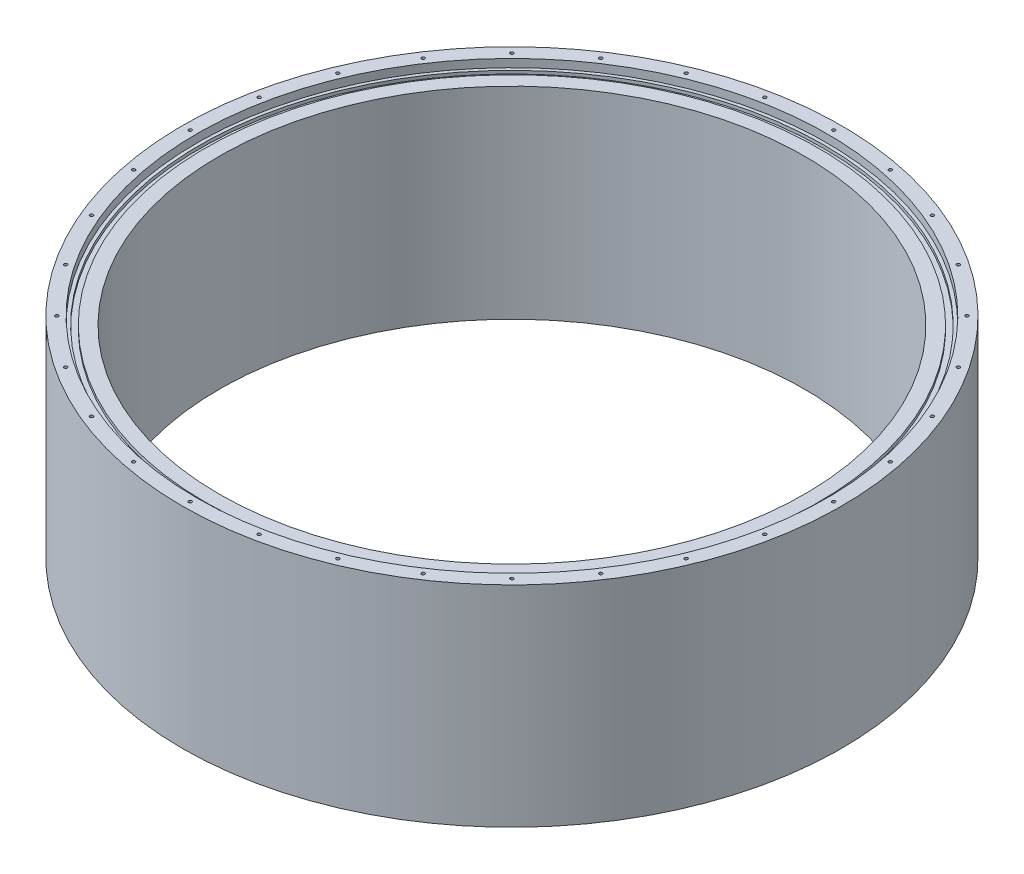
from build123d import *

# Parameters (mm, degrees)
SKETCH2_W                 = 4.1656
SKETCH2_H                 = 2.413
CIRPATTERN1_COUNT         = 32
F_5_0MM_DOWEL_HOLE1_D     = 5.05
F_5_0MM_DOWEL_HOLE1_DEPTH = 6
F_5_0MM_DOWEL_HOLE1_TIP   = 1.517173063


with BuildPart() as part:
    # Sketch1 → Revolve1 (revolve)
    with BuildSketch(Plane.XY, mode=Mode.PRIVATE) as revolve1_sk:
        Polygon((225.6, 74.685), (243, 74.685), (243, 80.885), (254, 80.885), (254, -80.885), (225.6, -80.885), align=None)
    revolve(revolve1_sk.sketch.rotate(Axis((0, 80.885, 0), (0, -1, 0)), 90), axis=Axis((0, 80.885, 0), (0, -1, 0)))

    # Sketch2 → Cut-Revolve1 (revolve, cut)
    with BuildSketch(Plane.XY, mode=Mode.PRIVATE) as cut_revolve1_sk:
        with Locations((238.4172, 73.4785)):
            Rectangle(SKETCH2_W, SKETCH2_H)
    revolve(cut_revolve1_sk.sketch.rotate(Axis((0, 80.885, 0), (0, -1, 0)), 90), axis=Axis((0, 80.885, 0), (0, -1, 0)), mode=Mode.SUBTRACT)

    # Sketch4 → M3x0.5 Tapped Hole1 (revolve, cut)
    with BuildSketch(Plane(origin=(248, 80.885, 0), x_dir=(0, 0, 1), z_dir=(1, 0, 0))):
        Polygon((0, 0), (0, 10.251075774), (1.25, 9.5), (1.25, 0), align=None)
    m3x0_5_tapped_hole1 = revolve(axis=Axis((248, 87.235, 0), (0, -1, 0)), mode=Mode.SUBTRACT)

    # CirPattern1: M3x0.5 Tapped Hole1 ×32 about axis
    cirpattern1_axis = Axis((0, 0, 0), (0, 1, 0))
    for i in range(1, CIRPATTERN1_COUNT):
        add(m3x0_5_tapped_hole1.rotate(cirpattern1_axis, i * 360 / CIRPATTERN1_COUNT), mode=Mode.SUBTRACT)

    # Mirror1: M3x0.5 Tapped Hole1 across plane
    add(m3x0_5_tapped_hole1.mirror(Plane.ZX), mode=Mode.SUBTRACT)

    # Mirror1 copy 1 sketch → Mirror1 copy 1 (revolve, cut)
    with BuildSketch(Plane(origin=(243.23474954, -80.885, -48.38239986), x_dir=(0.19509032201612825, 0, 0.9807852804032304), z_dir=(0.9807852804032304, 0, -0.19509032201612825))):
        Polygon((0, 0), (0, -10.251075774), (1.25, -9.5), (1.25, 0), align=None)
    revolve(axis=Axis((243.23474954, -87.235, -48.38239986), (0, -1, 0)), mode=Mode.SUBTRACT)

    # Mirror1 copy 2 sketch → Mirror1 copy 2 (revolve, cut)
    with BuildSketch(Plane(origin=(229.122124063, -80.885, -94.905491227), x_dir=(0.3826834323650898, 0, 0.9238795325112867), z_dir=(0.9238795325112867, 0, -0.3826834323650898))):
        Polygon((0, 0), (0, -10.251075774), (1.25, -9.5), (1.25, 0), align=None)
    revolve(axis=Axis((229.122124063, -87.235, -94.905491227), (0, -1, 0)), mode=Mode.SUBTRACT)

    # Mirror1 copy 3 sketch → Mirror1 copy 3 (revolve, cut)
    with BuildSketch(Plane(origin=(206.204463851, -80.885, -137.781417789), x_dir=(0.5555702330196022, 0, 0.8314696123025452), z_dir=(0.8314696123025452, 0, -0.5555702330196022))):
        Polygon((0, 0), (0, -10.251075774), (1.25, -9.5), (1.25, 0), align=None)
    revolve(axis=Axis((206.204463851, -87.235, -137.781417789), (0, -1, 0)), mode=Mode.SUBTRACT)

    # Mirror1 copy 4 sketch → Mirror1 copy 4 (revolve, cut)
    with BuildSketch(Plane(origin=(175.362481734, -80.885, -175.362481734), x_dir=(0.7071067811865475, 0, 0.7071067811865476), z_dir=(0.7071067811865476, 0, -0.7071067811865475))):
        Polygon((0, 0), (0, -10.251075774), (1.25, -9.5), (1.25, 0), align=None)
    revolve(axis=Axis((175.362481734, -87.235, -175.362481734), (0, -1, 0)), mode=Mode.SUBTRACT)

    # Mirror1 copy 5 sketch → Mirror1 copy 5 (revolve, cut)
    with BuildSketch(Plane(origin=(137.781417789, -80.885, -206.204463851), x_dir=(0.8314696123025452, 0, 0.5555702330196023), z_dir=(0.5555702330196023, 0, -0.8314696123025452))):
        Polygon((0, 0), (0, -10.251075774), (1.25, -9.5), (1.25, 0), align=None)
    revolve(axis=Axis((137.781417789, -87.235, -206.204463851), (0, -1, 0)), mode=Mode.SUBTRACT)

    # Mirror1 copy 6 sketch → Mirror1 copy 6 (revolve, cut)
    with BuildSketch(Plane(origin=(94.905491227, -80.885, -229.122124063), x_dir=(0.9238795325112867, 0, 0.38268343236508984), z_dir=(0.38268343236508984, 0, -0.9238795325112867))):
        Polygon((0, 0), (0, -10.251075774), (1.25, -9.5), (1.25, 0), align=None)
    revolve(axis=Axis((94.905491227, -87.235, -229.122124063), (0, -1, 0)), mode=Mode.SUBTRACT)

    # Mirror1 copy 7 sketch → Mirror1 copy 7 (revolve, cut)
    with BuildSketch(Plane(origin=(48.38239986, -80.885, -243.23474954), x_dir=(0.9807852804032304, 0, 0.19509032201612833), z_dir=(0.19509032201612833, 0, -0.9807852804032304))):
        Polygon((0, 0), (0, -10.251075774), (1.25, -9.5), (1.25, 0), align=None)
    revolve(axis=Axis((48.38239986, -87.235, -243.23474954), (0, -1, 0)), mode=Mode.SUBTRACT)

    # Mirror1 copy 8 sketch → Mirror1 copy 8 (revolve, cut)
    with BuildSketch(Plane(origin=(0, -80.885, -248), x_dir=(1, 0, 0), z_dir=(0, 0, -1))):
        Polygon((0, 0), (0, -10.251075774), (1.25, -9.5), (1.25, 0), align=None)
    revolve(axis=Axis((0, -87.235, -248), (0, -1, 0)), mode=Mode.SUBTRACT)

    # Mirror1 copy 9 sketch → Mirror1 copy 9 (revolve, cut)
    with BuildSketch(Plane(origin=(-48.38239986, -80.885, -243.23474954), x_dir=(0.9807852804032304, 0, -0.1950903220161282), z_dir=(-0.1950903220161282, 0, -0.9807852804032304))):
        Polygon((0, 0), (0, -10.251075774), (1.25, -9.5), (1.25, 0), align=None)
    revolve(axis=Axis((-48.38239986, -87.235, -243.23474954), (0, -1, 0)), mode=Mode.SUBTRACT)

    # Mirror1 copy 10 sketch → Mirror1 copy 10 (revolve, cut)
    with BuildSketch(Plane(origin=(-94.905491227, -80.885, -229.122124063), x_dir=(0.9238795325112867, 0, -0.3826834323650897), z_dir=(-0.3826834323650897, 0, -0.9238795325112867))):
        Polygon((0, 0), (0, -10.251075774), (1.25, -9.5), (1.25, 0), align=None)
    revolve(axis=Axis((-94.905491227, -87.235, -229.122124063), (0, -1, 0)), mode=Mode.SUBTRACT)

    # Mirror1 copy 11 sketch → Mirror1 copy 11 (revolve, cut)
    with BuildSketch(Plane(origin=(-137.781417789, -80.885, -206.204463851), x_dir=(0.8314696123025451, 0, -0.5555702330196023), z_dir=(-0.5555702330196023, 0, -0.8314696123025451))):
        Polygon((0, 0), (0, -10.251075774), (1.25, -9.5), (1.25, 0), align=None)
    revolve(axis=Axis((-137.781417789, -87.235, -206.204463851), (0, -1, 0)), mode=Mode.SUBTRACT)

    # Mirror1 copy 12 sketch → Mirror1 copy 12 (revolve, cut)
    with BuildSketch(Plane(origin=(-175.362481734, -80.885, -175.362481734), x_dir=(0.7071067811865476, 0, -0.7071067811865475), z_dir=(-0.7071067811865475, 0, -0.7071067811865476))):
        Polygon((0, 0), (0, -10.251075774), (1.25, -9.5), (1.25, 0), align=None)
    revolve(axis=Axis((-175.362481734, -87.235, -175.362481734), (0, -1, 0)), mode=Mode.SUBTRACT)

    # Mirror1 copy 13 sketch → Mirror1 copy 13 (revolve, cut)
    with BuildSketch(Plane(origin=(-206.204463851, -80.885, -137.781417789), x_dir=(0.5555702330196022, 0, -0.8314696123025453), z_dir=(-0.8314696123025453, 0, -0.5555702330196022))):
        Polygon((0, 0), (0, -10.251075774), (1.25, -9.5), (1.25, 0), align=None)
    revolve(axis=Axis((-206.204463851, -87.235, -137.781417789), (0, -1, 0)), mode=Mode.SUBTRACT)

    # Mirror1 copy 14 sketch → Mirror1 copy 14 (revolve, cut)
    with BuildSketch(Plane(origin=(-229.122124063, -80.885, -94.905491227), x_dir=(0.3826834323650899, 0, -0.9238795325112867), z_dir=(-0.9238795325112867, 0, -0.3826834323650899))):
        Polygon((0, 0), (0, -10.251075774), (1.25, -9.5), (1.25, 0), align=None)
    revolve(axis=Axis((-229.122124063, -87.235, -94.905491227), (0, -1, 0)), mode=Mode.SUBTRACT)

    # Mirror1 copy 15 sketch → Mirror1 copy 15 (revolve, cut)
    with BuildSketch(Plane(origin=(-243.23474954, -80.885, -48.38239986), x_dir=(0.19509032201612816, 0, -0.9807852804032304), z_dir=(-0.9807852804032304, 0, -0.19509032201612816))):
        Polygon((0, 0), (0, -10.251075774), (1.25, -9.5), (1.25, 0), align=None)
    revolve(axis=Axis((-243.23474954, -87.235, -48.38239986), (0, -1, 0)), mode=Mode.SUBTRACT)

    # Mirror1 copy 16 sketch → Mirror1 copy 16 (revolve, cut)
    with BuildSketch(Plane(origin=(-248, -80.885, 0), x_dir=(0, 0, -1), z_dir=(-1, 0, 0))):
        Polygon((0, 0), (0, -10.251075774), (1.25, -9.5), (1.25, 0), align=None)
    revolve(axis=Axis((-248, -87.235, 0), (0, -1, 0)), mode=Mode.SUBTRACT)

    # Mirror1 copy 17 sketch → Mirror1 copy 17 (revolve, cut)
    with BuildSketch(Plane(origin=(-243.23474954, -80.885, 48.38239986), x_dir=(-0.19509032201612836, 0, -0.9807852804032304), z_dir=(-0.9807852804032304, 0, 0.19509032201612836))):
        Polygon((0, 0), (0, -10.251075774), (1.25, -9.5), (1.25, 0), align=None)
    revolve(axis=Axis((-243.23474954, -87.235, 48.38239986), (0, -1, 0)), mode=Mode.SUBTRACT)

    # Mirror1 copy 18 sketch → Mirror1 copy 18 (revolve, cut)
    with BuildSketch(Plane(origin=(-229.122124063, -80.885, 94.905491227), x_dir=(-0.38268343236508967, 0, -0.9238795325112868), z_dir=(-0.9238795325112868, 0, 0.38268343236508967))):
        Polygon((0, 0), (0, -10.251075774), (1.25, -9.5), (1.25, 0), align=None)
    revolve(axis=Axis((-229.122124063, -87.235, 94.905491227), (0, -1, 0)), mode=Mode.SUBTRACT)

    # Mirror1 copy 19 sketch → Mirror1 copy 19 (revolve, cut)
    with BuildSketch(Plane(origin=(-206.204463851, -80.885, 137.781417789), x_dir=(-0.5555702330196023, 0, -0.8314696123025452), z_dir=(-0.8314696123025452, 0, 0.5555702330196023))):
        Polygon((0, 0), (0, -10.251075774), (1.25, -9.5), (1.25, 0), align=None)
    revolve(axis=Axis((-206.204463851, -87.235, 137.781417789), (0, -1, 0)), mode=Mode.SUBTRACT)

    # Mirror1 copy 20 sketch → Mirror1 copy 20 (revolve, cut)
    with BuildSketch(Plane(origin=(-175.362481734, -80.885, 175.362481734), x_dir=(-0.7071067811865475, 0, -0.7071067811865477), z_dir=(-0.7071067811865477, 0, 0.7071067811865475))):
        Polygon((0, 0), (0, -10.251075774), (1.25, -9.5), (1.25, 0), align=None)
    revolve(axis=Axis((-175.362481734, -87.235, 175.362481734), (0, -1, 0)), mode=Mode.SUBTRACT)

    # Mirror1 copy 21 sketch → Mirror1 copy 21 (revolve, cut)
    with BuildSketch(Plane(origin=(-137.781417789, -80.885, 206.204463851), x_dir=(-0.8314696123025452, 0, -0.5555702330196022), z_dir=(-0.5555702330196022, 0, 0.8314696123025452))):
        Polygon((0, 0), (0, -10.251075774), (1.25, -9.5), (1.25, 0), align=None)
    revolve(axis=Axis((-137.781417789, -87.235, 206.204463851), (0, -1, 0)), mode=Mode.SUBTRACT)

    # Mirror1 copy 22 sketch → Mirror1 copy 22 (revolve, cut)
    with BuildSketch(Plane(origin=(-94.905491227, -80.885, 229.122124063), x_dir=(-0.9238795325112868, 0, -0.3826834323650895), z_dir=(-0.3826834323650895, 0, 0.9238795325112868))):
        Polygon((0, 0), (0, -10.251075774), (1.25, -9.5), (1.25, 0), align=None)
    revolve(axis=Axis((-94.905491227, -87.235, 229.122124063), (0, -1, 0)), mode=Mode.SUBTRACT)

    # Mirror1 copy 23 sketch → Mirror1 copy 23 (revolve, cut)
    with BuildSketch(Plane(origin=(-48.38239986, -80.885, 243.23474954), x_dir=(-0.9807852804032303, 0, -0.19509032201612866), z_dir=(-0.19509032201612866, 0, 0.9807852804032303))):
        Polygon((0, 0), (0, -10.251075774), (1.25, -9.5), (1.25, 0), align=None)
    revolve(axis=Axis((-48.38239986, -87.235, 243.23474954), (0, -1, 0)), mode=Mode.SUBTRACT)

    # Mirror1 copy 24 sketch → Mirror1 copy 24 (revolve, cut)
    with BuildSketch(Plane(origin=(0, -80.885, 248), x_dir=(-1, 0, 0), z_dir=(0, 0, 1))):
        Polygon((0, 0), (0, -10.251075774), (1.25, -9.5), (1.25, 0), align=None)
    revolve(axis=Axis((0, -87.235, 248), (0, -1, 0)), mode=Mode.SUBTRACT)

    # Mirror1 copy 25 sketch → Mirror1 copy 25 (revolve, cut)
    with BuildSketch(Plane(origin=(48.38239986, -80.885, 243.23474954), x_dir=(-0.9807852804032304, 0, 0.1950903220161283), z_dir=(0.1950903220161283, 0, 0.9807852804032304))):
        Polygon((0, 0), (0, -10.251075774), (1.25, -9.5), (1.25, 0), align=None)
    revolve(axis=Axis((48.38239986, -87.235, 243.23474954), (0, -1, 0)), mode=Mode.SUBTRACT)

    # Mirror1 copy 26 sketch → Mirror1 copy 26 (revolve, cut)
    with BuildSketch(Plane(origin=(94.905491227, -80.885, 229.122124063), x_dir=(-0.9238795325112866, 0, 0.38268343236509), z_dir=(0.38268343236509, 0, 0.9238795325112866))):
        Polygon((0, 0), (0, -10.251075774), (1.25, -9.5), (1.25, 0), align=None)
    revolve(axis=Axis((94.905491227, -87.235, 229.122124063), (0, -1, 0)), mode=Mode.SUBTRACT)

    # Mirror1 copy 27 sketch → Mirror1 copy 27 (revolve, cut)
    with BuildSketch(Plane(origin=(137.781417789, -80.885, 206.204463851), x_dir=(-0.8314696123025455, 0, 0.5555702330196018), z_dir=(0.5555702330196018, 0, 0.8314696123025455))):
        Polygon((0, 0), (0, -10.251075774), (1.25, -9.5), (1.25, 0), align=None)
    revolve(axis=Axis((137.781417789, -87.235, 206.204463851), (0, -1, 0)), mode=Mode.SUBTRACT)

    # Mirror1 copy 28 sketch → Mirror1 copy 28 (revolve, cut)
    with BuildSketch(Plane(origin=(175.362481734, -80.885, 175.362481734), x_dir=(-0.7071067811865477, 0, 0.7071067811865474), z_dir=(0.7071067811865474, 0, 0.7071067811865477))):
        Polygon((0, 0), (0, -10.251075774), (1.25, -9.5), (1.25, 0), align=None)
    revolve(axis=Axis((175.362481734, -87.235, 175.362481734), (0, -1, 0)), mode=Mode.SUBTRACT)

    # Mirror1 copy 29 sketch → Mirror1 copy 29 (revolve, cut)
    with BuildSketch(Plane(origin=(206.204463851, -80.885, 137.781417789), x_dir=(-0.5555702330196022, 0, 0.8314696123025452), z_dir=(0.8314696123025452, 0, 0.5555702330196022))):
        Polygon((0, 0), (0, -10.251075774), (1.25, -9.5), (1.25, 0), align=None)
    revolve(axis=Axis((206.204463851, -87.235, 137.781417789), (0, -1, 0)), mode=Mode.SUBTRACT)

    # Mirror1 copy 30 sketch → Mirror1 copy 30 (revolve, cut)
    with BuildSketch(Plane(origin=(229.122124063, -80.885, 94.905491227), x_dir=(-0.38268343236508956, 0, 0.9238795325112868), z_dir=(0.9238795325112868, 0, 0.38268343236508956))):
        Polygon((0, 0), (0, -10.251075774), (1.25, -9.5), (1.25, 0), align=None)
    revolve(axis=Axis((229.122124063, -87.235, 94.905491227), (0, -1, 0)), mode=Mode.SUBTRACT)

    # Mirror1 copy 31 sketch → Mirror1 copy 31 (revolve, cut)
    with BuildSketch(Plane(origin=(243.23474954, -80.885, 48.38239986), x_dir=(-0.19509032201612872, 0, 0.9807852804032303), z_dir=(0.9807852804032303, 0, 0.19509032201612872))):
        Polygon((0, 0), (0, -10.251075774), (1.25, -9.5), (1.25, 0), align=None)
    revolve(axis=Axis((243.23474954, -87.235, 48.38239986), (0, -1, 0)), mode=Mode.SUBTRACT)

    # Ø5.0mm Dowel Hole1
    with Locations(Plane(origin=(0, -80.885, 0), x_dir=(-1, 0, 0), z_dir=(0, -1, 0))):
        with Locations((23.769746625, -246.858257195), (-23.769746625, 246.858257195)):
            Hole(F_5_0MM_DOWEL_HOLE1_D / 2, depth=F_5_0MM_DOWEL_HOLE1_DEPTH)
            with Locations((0, 0, -(F_5_0MM_DOWEL_HOLE1_DEPTH + F_5_0MM_DOWEL_HOLE1_TIP / 2))):  # 118° drill point
                Cone(0, F_5_0MM_DOWEL_HOLE1_D / 2, F_5_0MM_DOWEL_HOLE1_TIP, mode=Mode.SUBTRACT)


solid = part.part
